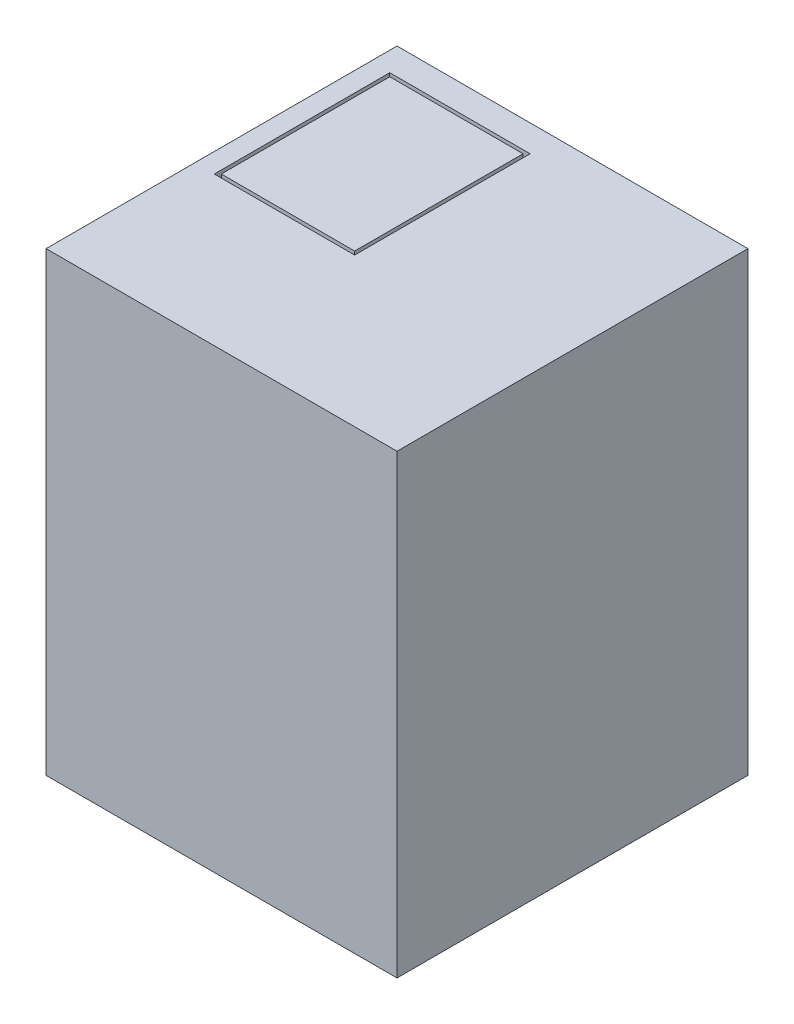
from build123d import *

# Parameters (mm, degrees)
SKETCH1_W           = 100
SKETCH1_H           = 100
BOSS_EXTRUDE1_DEPTH = 130
SKETCH2_W           = 40
SKETCH2_H           = 50
CUT_EXTRUDE1_DEPTH  = 5
SKETCH3_W           = 38
SKETCH3_H           = 48
BOSS_EXTRUDE2_DEPTH = 5


with BuildPart() as part:
    # Sketch1 → Boss-Extrude1 (new body)
    with BuildSketch(Plane(origin=(0, 0, 0), x_dir=(1, 0, 0), z_dir=(0, 1, 0))):
        Rectangle(SKETCH1_W, SKETCH1_H)
    extrude(amount=BOSS_EXTRUDE1_DEPTH)

    # Sketch2 → Cut-Extrude1 (cut)
    with BuildSketch(Plane(origin=(0, 130, 0), x_dir=(1, 0, 0), z_dir=(0, 1, 0))):
        with Locations((-24.43959223, 17.370310973)):
            Rectangle(SKETCH2_W, SKETCH2_H)
    extrude(amount=-CUT_EXTRUDE1_DEPTH, mode=Mode.SUBTRACT)

    # Sketch3 → Boss-Extrude2 (add)
    with BuildSketch(Plane(origin=(0, 125, 0), x_dir=(1, 0, 0), z_dir=(0, 1, 0))):
        with Locations((-24.43959223, 17.370310973)):
            Rectangle(SKETCH3_W, SKETCH3_H)
    extrude(amount=BOSS_EXTRUDE2_DEPTH)


solid = part.part
